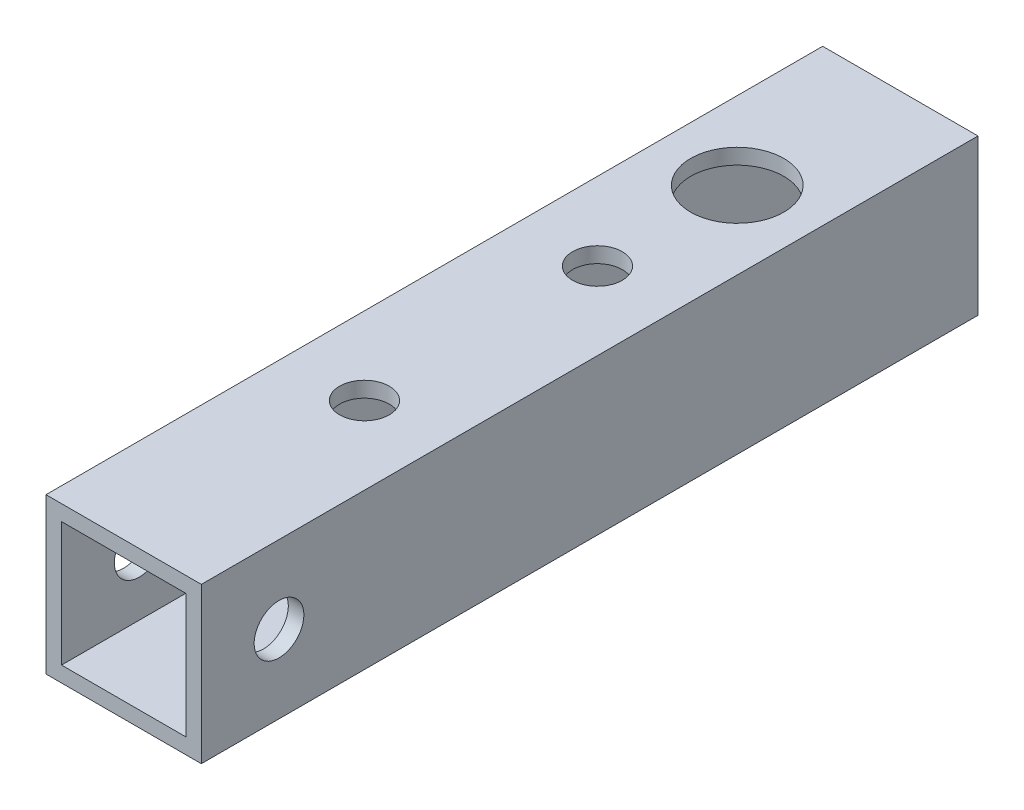
from build123d import *

# Parameters (mm, degrees)
SKETCH_1_W          = 10
SKETCH_1_H          = 10
SKETCH_1_W_2        = 8
SKETCH_1_H_2        = 8
EXTRUDE_1_DEPTH     = 50
SKETCH_2_R          = 3
SKETCH_2_R_2        = 1.6
CUT_EXTRUDE_1_DEPTH = 52.961524227
CUT_EXTRUDE_2_REACH = 53.962
SKETCH_4_R          = 2.6
SKETCH_6_R          = 1.6
CUT_EXTRUDE_4_DEPTH = 52.961524227


with BuildPart() as part:
    # ｽｹｯﾁ1 → 押し出し-薄板1 (new body)
    with BuildSketch(Plane.XY):
        with Locations((5, 5)):
            Rectangle(SKETCH_1_W, SKETCH_1_H)
        with Locations((5, 5)):
            Rectangle(SKETCH_1_W_2, SKETCH_1_H_2, mode=Mode.SUBTRACT)
    extrude(amount=EXTRUDE_1_DEPTH)

    # ｽｹｯﾁ2 → ｶｯﾄ - 押し出し1 (cut, through all)
    with BuildSketch(Plane(origin=(0, 10, 0), x_dir=(1, 0, 0), z_dir=(0, 1, 0))):
        with Locations(Location((5, -10.5, 0), (0, 0, 270))):
            Circle(SKETCH_2_R)
        with Locations(Location((5, -19.5, 0), (0, 0, 270))):
            Circle(SKETCH_2_R_2)
        with Locations(Location((5, -34.5, 0), (0, 0, 270))):
            Circle(SKETCH_2_R_2)
    extrude(amount=-CUT_EXTRUDE_1_DEPTH, mode=Mode.SUBTRACT)

    # ｽｹｯﾁ4 → ｶｯﾄ - 押し出し2 (cut, up to next)
    with BuildSketch(Plane.XZ, mode=Mode.PRIVATE) as cut_extrude_2_sk1:
        with Locations(Location((5, 19.5, 0), (0, 0, 270))):
            Circle(SKETCH_4_R)
    cut_extrude_2_tool1 = extrude(cut_extrude_2_sk1.sketch, amount=-CUT_EXTRUDE_2_REACH, mode=Mode.PRIVATE) & part.part
    add(cut_extrude_2_tool1.solids().sort_by_distance((5, 0, 19.5))[0], mode=Mode.SUBTRACT)

    # ｽｹｯﾁ6 → ｶｯﾄ - 押し出し4 (cut, through all)
    with BuildSketch(Plane(origin=(10, 0, 0), x_dir=(0, 0, -1), z_dir=(1, 0, 0))):
        with Locations(Location((-45, 5, 0), (0, 0, 90))):
            Circle(SKETCH_6_R)
    extrude(amount=-CUT_EXTRUDE_4_DEPTH, mode=Mode.SUBTRACT)


solid = part.part
